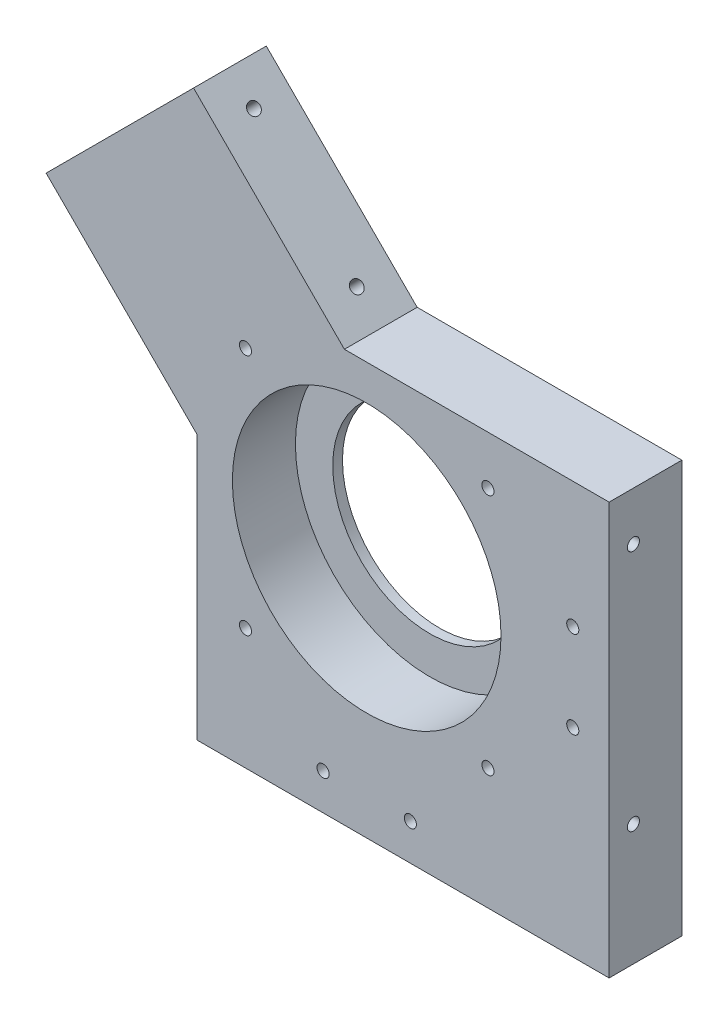
from build123d import *

# Parameters (mm, degrees)
SKETCH1_R           = 27.7
SKETCH1_R_2         = 1.25
BOSS_EXTRUDE1_DEPTH = 15
CUT_EXTRUDE1_REACH  = 107.304
SKETCH2_R           = 1.25
SKETCH6_R           = 27.7
SKETCH6_R_2         = 20
BOSS_EXTRUDE4_DEPTH = 2
SKETCH7_R           = 1.25
CUT_EXTRUDE2_DEPTH  = 15
SKETCH8_R           = 1.25
CUT_EXTRUDE3_DEPTH  = 15


with BuildPart() as part:
    # Sketch1 → Boss-Extrude1 (new body)
    with BuildSketch(Plane.XY):
        Polygon((50, 35), (50, -50), (-35, -50), (-35, 4.594408409), (-66.114484041, 35.70889245), (-50.911688245, 50.911688245), (-35.70889245, 66.114484041), (-4.594408409, 35), align=None)
        Circle(SKETCH1_R, mode=Mode.SUBTRACT)
        with Locations((-25, 25)):
            Circle(SKETCH1_R_2, mode=Mode.SUBTRACT)
        with Locations((25, 25)):
            Circle(SKETCH1_R_2, mode=Mode.SUBTRACT)
        with Locations((25, -25)):
            Circle(SKETCH1_R_2, mode=Mode.SUBTRACT)
        with Locations((-25, -25)):
            Circle(SKETCH1_R_2, mode=Mode.SUBTRACT)
        with Locations((42.5, 9)):
            Circle(SKETCH1_R_2, mode=Mode.SUBTRACT)
        with Locations((42.5, -9)):
            Circle(SKETCH1_R_2, mode=Mode.SUBTRACT)
        with Locations((9, -42.5)):
            Circle(SKETCH1_R_2, mode=Mode.SUBTRACT)
        with Locations((-9, -42.5)):
            Circle(SKETCH1_R_2, mode=Mode.SUBTRACT)
    extrude(amount=BOSS_EXTRUDE1_DEPTH)

    # Sketch2 → Cut-Extrude1 (cut, up to next)
    with BuildSketch(Plane(origin=(-15.202795796, -15.202795796, 0), x_dir=(0, 0, 1), z_dir=(-0.7071067811865472, -0.7071067811865478, 0)), mode=Mode.PRIVATE) as cut_extrude1_sk1:
        with Locations(Location((7.5, 65, 0), (0, 0, 270))):
            Circle(SKETCH2_R)
    cut_extrude1_tool1 = extrude(cut_extrude1_sk1.sketch, amount=-CUT_EXTRUDE1_REACH, mode=Mode.PRIVATE) & part.part
    # Sketch2 → Cut-Extrude1 (cut, up to next)
    with BuildSketch(Plane(origin=(-15.202795796, -15.202795796, 0), x_dir=(0, 0, 1), z_dir=(-0.7071067811865472, -0.7071067811865478, 0)), mode=Mode.PRIVATE) as cut_extrude1_sk2:
        with Locations(Location((7.5, 35, 0), (0, 0, 270))):
            Circle(SKETCH2_R)
    cut_extrude1_tool2 = extrude(cut_extrude1_sk2.sketch, amount=-CUT_EXTRUDE1_REACH, mode=Mode.PRIVATE) & part.part
    add(cut_extrude1_tool1.solids().sort_by_distance((-61.164737, 30.759145, 7.5))[0], mode=Mode.SUBTRACT)
    add(cut_extrude1_tool2.solids().sort_by_distance((-39.951533, 9.545942, 7.5))[0], mode=Mode.SUBTRACT)

    # Sketch6 → Boss-Extrude4 (add)
    with BuildSketch(Plane(origin=(0, 0, 0), x_dir=(-1, 0, 0), z_dir=(0, 0, -1))):
        Circle(SKETCH6_R)
        Circle(SKETCH6_R_2, mode=Mode.SUBTRACT)
    extrude(amount=-BOSS_EXTRUDE4_DEPTH)

    # Sketch7 → Cut-Extrude2 (cut)
    with BuildSketch(Plane.XZ.offset(50)):
        with Locations((25, 10)):
            Circle(SKETCH7_R)
        with Locations((-25, 10)):
            Circle(SKETCH7_R)
    extrude(amount=-CUT_EXTRUDE2_DEPTH, mode=Mode.SUBTRACT)

    # Sketch8 → Cut-Extrude3 (cut)
    with BuildSketch(Plane(origin=(50, 0, 0), x_dir=(0, 0, -1), z_dir=(1, 0, 0))):
        with Locations(Location((-10, -25, 0), (0, 0, 90))):
            Circle(SKETCH8_R)
        with Locations(Location((-10, 25, 0), (0, 0, 90))):
            Circle(SKETCH8_R)
    extrude(amount=-CUT_EXTRUDE3_DEPTH, mode=Mode.SUBTRACT)


solid = part.part
